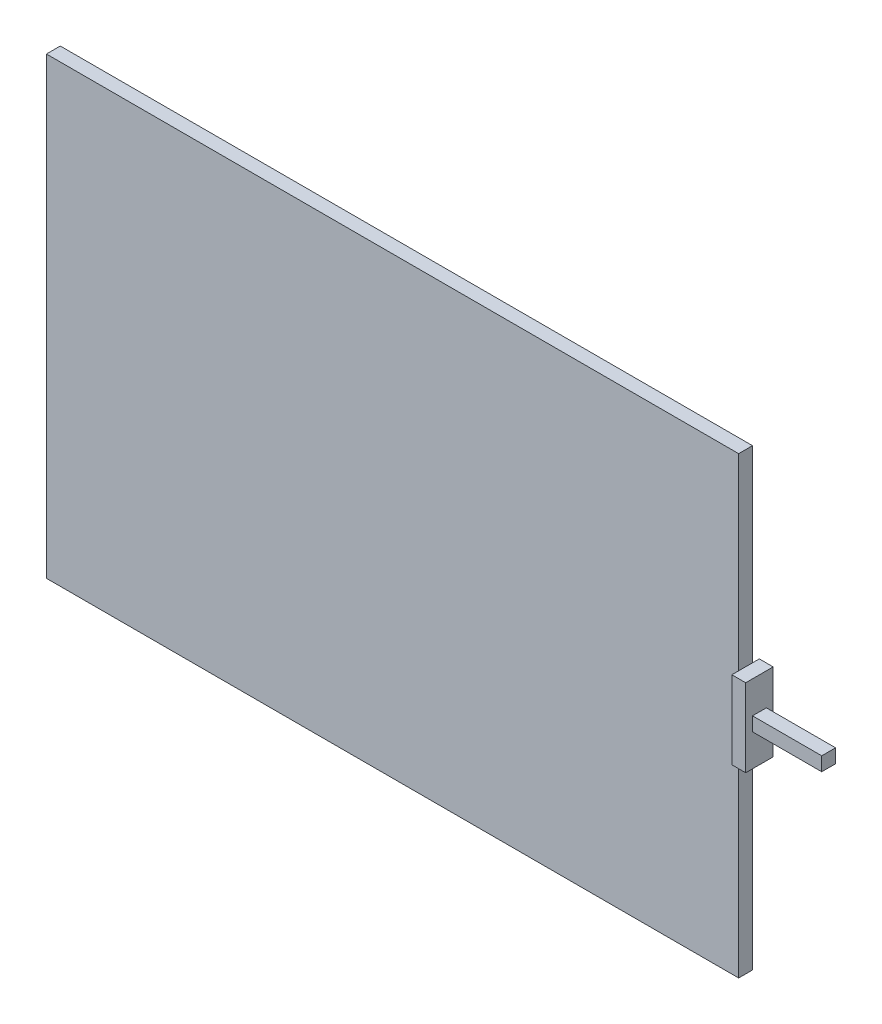
from build123d import *

# Parameters (mm, degrees)
SKETCH1_W           = 100
SKETCH1_H           = 65.6
BOSS_EXTRUDE1_DEPTH = 2
SKETCH2_W           = 3.96828804
SKETCH2_H           = 11.261454498
BOSS_EXTRUDE2_DEPTH = 2
SKETCH3_W           = 2
SKETCH3_H           = 2
BOSS_EXTRUDE3_DEPTH = 10


with BuildPart() as part:
    # Sketch1 → Boss-Extrude1 (new body)
    with BuildSketch(Plane.XY):
        Rectangle(SKETCH1_W, SKETCH1_H)
    extrude(amount=BOSS_EXTRUDE1_DEPTH)

    # Sketch2 → Boss-Extrude2 (add)
    with BuildSketch(Plane(origin=(50, 0, 0), x_dir=(0, 0, -1), z_dir=(1, 0, 0))):
        with Locations((-1, 0)):
            Rectangle(SKETCH2_W, SKETCH2_H)
    extrude(amount=BOSS_EXTRUDE2_DEPTH)

    # Sketch3 → Boss-Extrude3 (add)
    with BuildSketch(Plane(origin=(52, 0, 0), x_dir=(0, 0, -1), z_dir=(1, 0, 0))):
        with Locations((-1, 0)):
            Rectangle(SKETCH3_W, SKETCH3_H)
    extrude(amount=BOSS_EXTRUDE3_DEPTH)


solid = part.part
